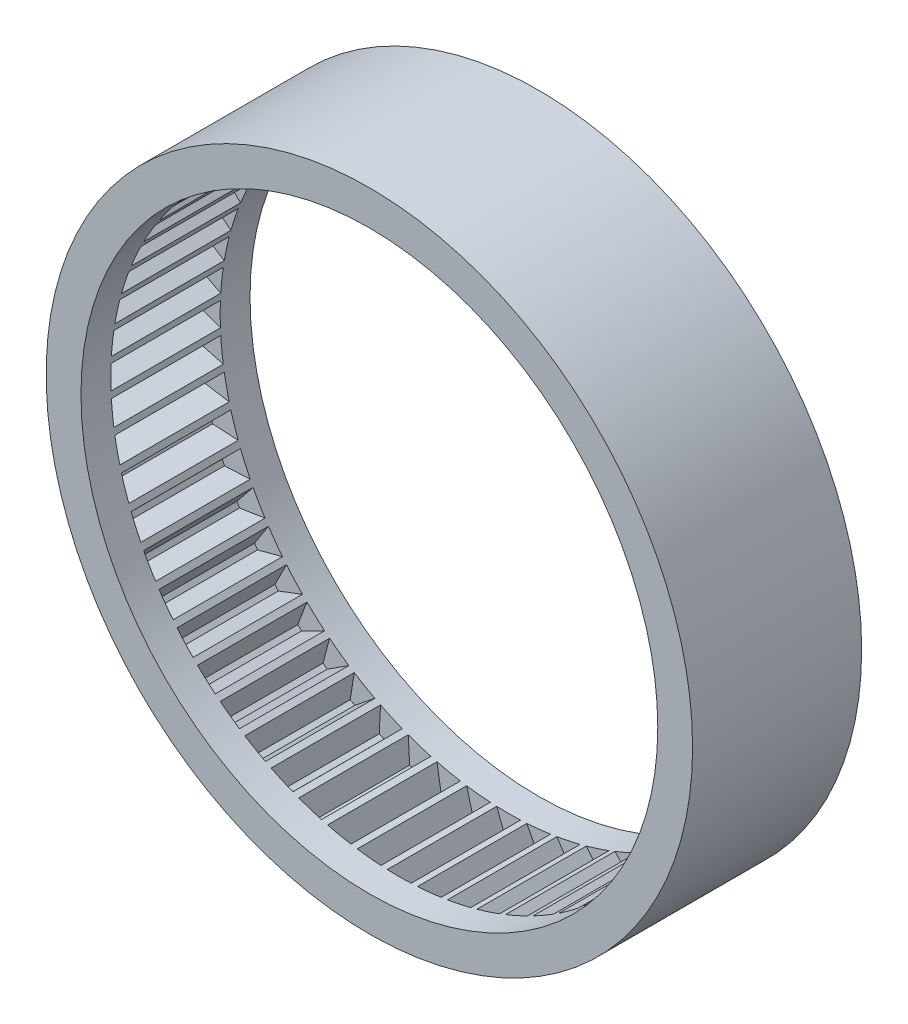
from build123d import *

# Parameters (mm, degrees)
BOSS_EXTRU_3_START           = -18
ESQUISSE5_R                  = 32.5
ESQUISSE5_R_2                = 29
BOSS_EXTRU_3_DEPTH           = 17
ENL_V_MAT_EXTRU_2_DEPTH      = 5.5
R_P_TITION_CIRCULAIRE2_COUNT = 60


with BuildPart() as part:
    # Esquisse5 → Boss.-Extru.3 (new body)
    with BuildSketch(Plane.XY.offset(BOSS_EXTRU_3_START)):
        Circle(ESQUISSE5_R)
        Circle(ESQUISSE5_R_2, mode=Mode.SUBTRACT)
    extrude(amount=-BOSS_EXTRU_3_DEPTH)

    # Esquisse6 → Enlèv. mat.-Extru.2 (cut, symmetric)
    with BuildSketch(Plane(origin=(0, 0, -26.5), x_dir=(-1, 0, 0), z_dir=(0, 0, -1))):
        Polygon((1.436016699, 28.909509892), (1.219643221, 28.920849545), (0.264229627, 31.39), (-0.264229627, 31.39), (-1.219643221, 28.920849545), (-1.436016699, 28.909509892), (-1.436016699, 28.737155891), (1.436016699, 28.737155891), align=None)
    enl_v_mat_extru_2 = extrude(amount=ENL_V_MAT_EXTRU_2_DEPTH, both=True, mode=Mode.SUBTRACT)

    # Répétition circulaire2: Enlèv. mat.-Extru.2 ×60 about axis
    r_p_tition_circulaire2_axis = Axis((0, 0, -18), (0, 0, -1))
    for i in range(1, R_P_TITION_CIRCULAIRE2_COUNT):
        add(enl_v_mat_extru_2.rotate(r_p_tition_circulaire2_axis, i * 360 / R_P_TITION_CIRCULAIRE2_COUNT), mode=Mode.SUBTRACT)


solid = part.part
